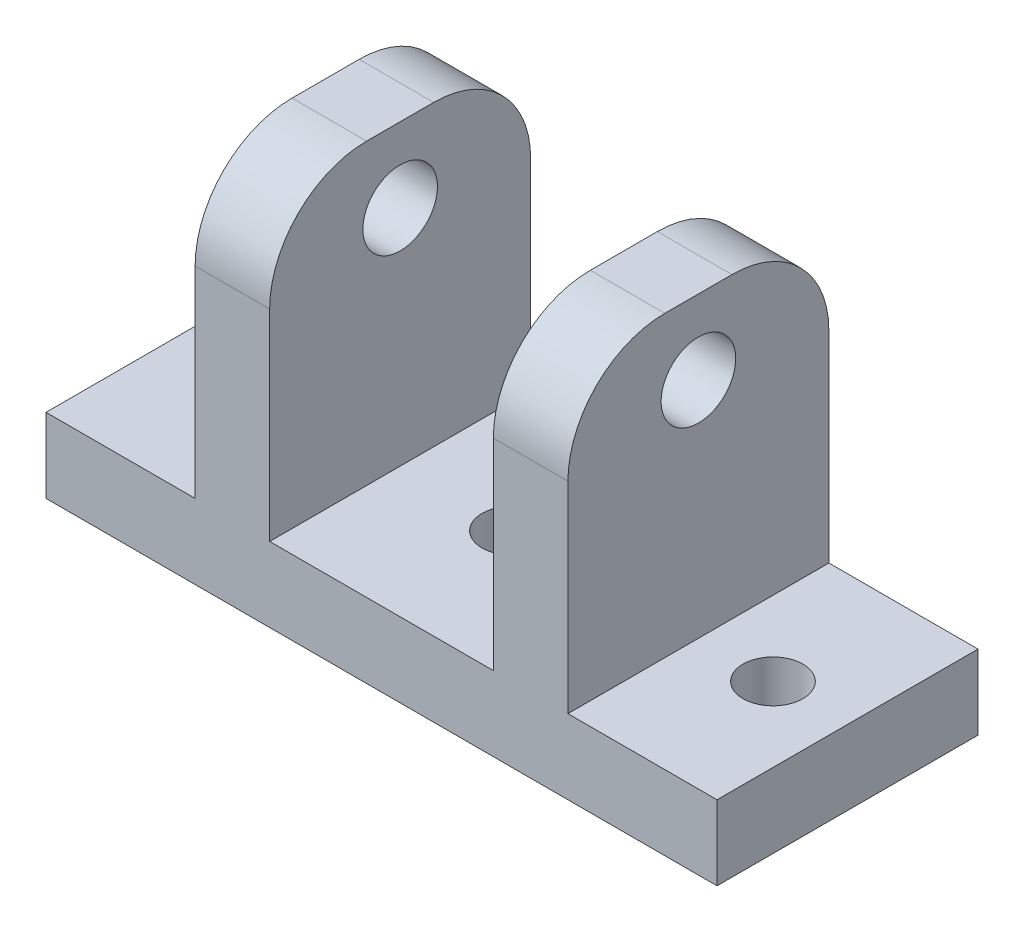
from build123d import *

# Parameters (mm, degrees)
SKETCH2_W                   = 12.7
SKETCH2_H                   = 22.225
BOSS_EXTRUDE1_DEPTH         = 6.35
SKETCH2_W_2                 = 19.05
BOSS_EXTRUDE1_2_DEPTH       = 6.35
BOSS_EXTRUDE1_3_DEPTH       = 6.35
SKETCH2_3_W                 = 6.35
SKETCH2_3_H                 = 22.225
BOSS_EXTRUDE2_DEPTH         = 31.75
SKETCH3_R                   = 3.175
CUT_EXTRUDE1_DEPTH          = 59.973007597
F_1_4_20_TAPPED_HOLE1_D     = 5.1054
F_1_4_20_TAPPED_HOLE1_DEPTH = 19.05
F_1_4_20_TAPPED_HOLE1_TIP   = 1.533816902
FILLET1_R                   = 8.255


with BuildPart() as part:
    # Sketch2 → Boss-Extrude1 (new body)
    with BuildSketch(Plane(origin=(0, 0, 0), x_dir=(1, 0, 0), z_dir=(0, 1, 0))):
        with Locations((6.35, 11.1125)):
            Rectangle(SKETCH2_W, SKETCH2_H)
    extrude(amount=BOSS_EXTRUDE1_DEPTH)



with BuildPart() as body_2:
    # Sketch2 → Boss-Extrude1 2 (new body)
    with BuildSketch(Plane(origin=(0, 0, 0), x_dir=(1, 0, 0), z_dir=(0, 1, 0))):
        with Locations((28.575, 11.1125)):
            Rectangle(SKETCH2_W_2, SKETCH2_H)
    extrude(amount=BOSS_EXTRUDE1_2_DEPTH)


with BuildPart() as body_3:
    # Sketch2 → Boss-Extrude1 3 (new body)
    with BuildSketch(Plane(origin=(0, 0, 0), x_dir=(1, 0, 0), z_dir=(0, 1, 0))):
        with Locations((50.8, 11.1125)):
            Rectangle(SKETCH2_W, SKETCH2_H)
    extrude(amount=BOSS_EXTRUDE1_3_DEPTH)


with BuildPart() as part_1:
    add(part.part)

    add(body_2.part)  # Boss-Extrude2 merges body 2

    add(body_3.part)  # Boss-Extrude2 merges body 3
    # Sketch2<3> → Boss-Extrude2 (add)
    with BuildSketch(Plane(origin=(0, 0, 0), x_dir=(1, 0, 0), z_dir=(0, 1, 0))):
        with Locations((15.875, 11.1125)):
            Rectangle(SKETCH2_3_W, SKETCH2_3_H)
        with Locations((41.275, 11.1125)):
            Rectangle(SKETCH2_3_W, SKETCH2_3_H)
    extrude(amount=BOSS_EXTRUDE2_DEPTH)

    # Sketch3 → Cut-Extrude1 (cut, through all)
    with BuildSketch(Plane.ZY.offset(-12.7)):
        with Locations((-11.1125, 25.4)):
            Circle(SKETCH3_R)
    extrude(amount=-CUT_EXTRUDE1_DEPTH, mode=Mode.SUBTRACT)

    # 1/4-20 Tapped Hole1
    with Locations(Plane(origin=(6.35, 6.35, -11.1125), x_dir=(0, 0, 1), z_dir=(0, 1, 0))):
        with Locations((0, 0), (0, 22.225), (0, 44.45)):
            Hole(F_1_4_20_TAPPED_HOLE1_D / 2, depth=F_1_4_20_TAPPED_HOLE1_DEPTH)
            with Locations((0, 0, -(F_1_4_20_TAPPED_HOLE1_DEPTH + F_1_4_20_TAPPED_HOLE1_TIP / 2))):  # 118° drill point
                Cone(0, F_1_4_20_TAPPED_HOLE1_D / 2, F_1_4_20_TAPPED_HOLE1_TIP, mode=Mode.SUBTRACT)

    # Fillet1
    fillet1_edges = [part_1.edges().sort_by_distance(p)[0] for p in [
        (15.875, 31.75, -22.225),
        (41.275, 31.75, -22.225),
        (41.275, 31.75, 0),
        (15.875, 31.75, 0),
    ]]
    fillet(fillet1_edges, radius=FILLET1_R)


solid = part_1.part
